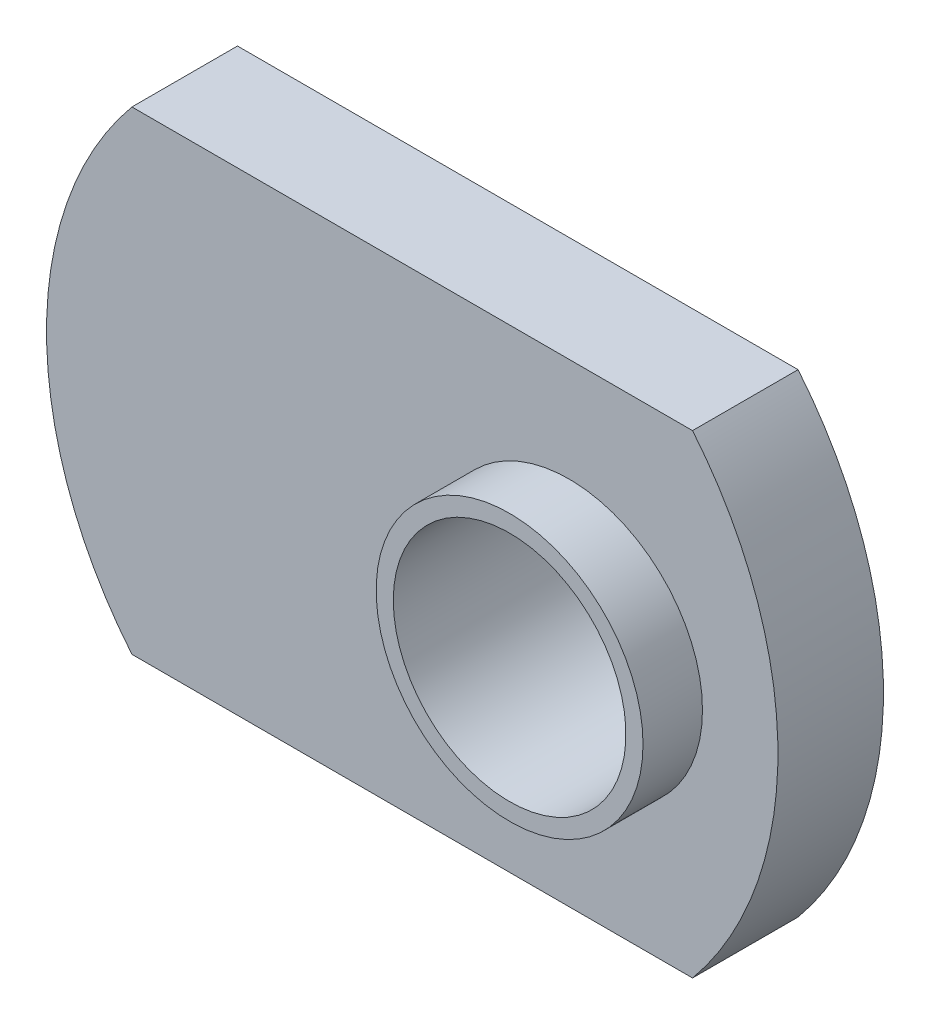
from build123d import *

# Parameters (mm, degrees)
EXTRUDE1_DEPTH     = 3.6068
SKETCH4_R          = 4.5593
EXTRUDE3_DEPTH     = 2.032
SKETCH6_R          = 3.9751
CUT_EXTRUDE1_DEPTH = 185.832411759


with BuildPart() as part:
    # Sketch1 → Extrude1 (new body)
    with BuildSketch(Plane.XY):
        with BuildLine():
            Line((102.341394541, 136.571387572), (121.498125987, 136.571387572))
            ThreePointArc((121.498125987, 136.571387572), (124.416560264, 128.471327572), (121.498125987, 120.371267572))
            Line((121.498125987, 120.371267572), (102.341394541, 120.371267572))
            ThreePointArc((102.341394541, 120.371267572), (99.422960264, 128.471327572), (102.341394541, 136.571387572))
        make_face()
    extrude(amount=EXTRUDE1_DEPTH)

    # Sketch4 → Extrude3 (add)
    with BuildSketch(Plane.XY.offset(3.6068)):
        with Locations((117.279160264, 128.471327572)):
            Circle(SKETCH4_R)
    extrude(amount=EXTRUDE3_DEPTH)

    # Sketch6 → Cut-Extrude1 (cut, through all)
    with BuildSketch(Plane(origin=(0, 0, 0), x_dir=(-1, 0, 0), z_dir=(0, 0, -1))):
        with Locations((-117.279160264, 128.471327572)):
            Circle(SKETCH6_R)
    extrude(amount=-CUT_EXTRUDE1_DEPTH, mode=Mode.SUBTRACT)


solid = part.part
